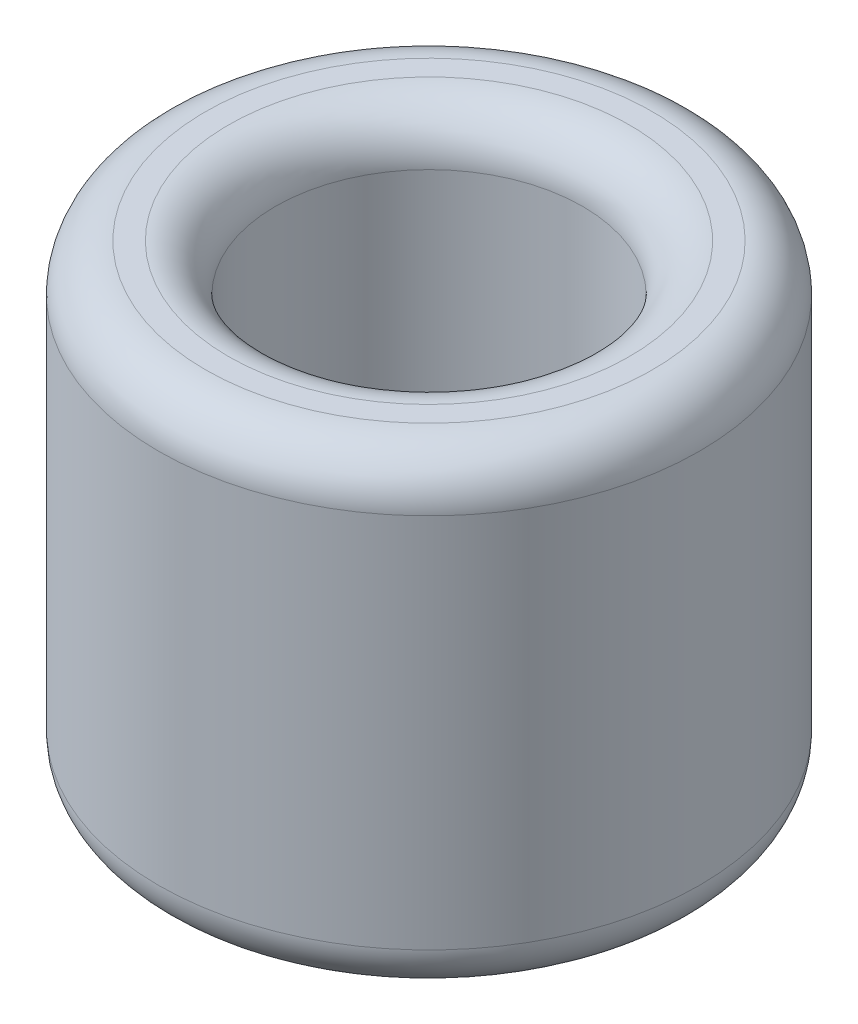
from build123d import *

# Parameters (mm, degrees)
SKETCH1_R           = 14.622116372
BOSS_EXTRUDE2_DEPTH = 25.4
SKETCH2_R           = 8.3
CUT_EXTRUDE1_DEPTH  = 25.4
FILLET1_R           = 2.54


with BuildPart() as part:
    # Sketch1 → Boss-Extrude2 (new body)
    with BuildSketch(Plane(origin=(0, 0, 0), x_dir=(1, 0, 0), z_dir=(0, 1, 0))):
        with Locations(Location((0, 0, 0), (0, 0, 270))):
            Circle(SKETCH1_R)
    extrude(amount=BOSS_EXTRUDE2_DEPTH)

    # Sketch2 → Cut-Extrude1 (cut)
    with BuildSketch(Plane(origin=(0, 25.4, 0), x_dir=(1, 0, 0), z_dir=(0, 1, 0))):
        with Locations(Location((0, 0, 0), (0, 0, 270))):
            Circle(SKETCH2_R)
    extrude(amount=-CUT_EXTRUDE1_DEPTH, mode=Mode.SUBTRACT)

    # Fillet1
    fillet1_edges = [part.edges().sort_by_distance(p)[0] for p in [
        (0, 0, -14.622116372),
        (0, 25.4, -14.622116372),
        (0, 0, -8.3),
        (0, 25.4, -8.3),
    ]]
    fillet(fillet1_edges, radius=FILLET1_R)


solid = part.part
